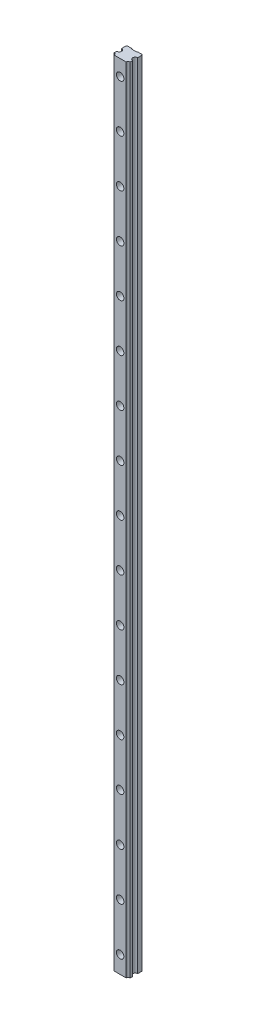
from build123d import *

# Parameters (mm, degrees)
RESSALTO_EXTRUS_O1_DEPTH = 1000
ESBO_O2_R                = 2.87
CORTE_EXTRUS_O1_DEPTH    = 17.57
ESBO_O3_R                = 4.715
CORTE_EXTRUS_O2_DEPTH    = 8.49


with BuildPart() as part:
    # Esboço1 → Ressalto-extrusão1 (new body)
    with BuildSketch(Plane(origin=(0, 0, 0), x_dir=(1, 0, 0), z_dir=(0, 1, 0))):
        with BuildLine():
            Line((-10.048, -3.265), (-10.048, -6.485))
            Line((-10.048, -6.485), (-9.645814792, -6.485))
            ThreePointArc((-9.645814792, -6.485), (-8.23160123, -7.070786438), (-7.645814792, -8.485))
            Line((-7.645814792, -8.485), (-7.645814792, -8.985))
            Line((-7.645814792, -8.985), (7.652, -8.985))
            Line((7.652, -8.985), (7.652, -8.485))
            ThreePointArc((7.652, -8.485), (8.237786438, -7.070786438), (9.652, -6.485))
            Line((9.652, -6.485), (10.152, -6.485))
            Line((10.152, -6.485), (10.152, -3.265))
            ThreePointArc((10.152, -3.265), (7.052, -0.165), (10.152, 2.935))
            Line((10.152, 2.935), (10.152, 8.315))
            Line((10.152, 8.315), (9.152, 9.315))
            Line((9.152, 9.315), (3.667, 9.315))
            Line((3.667, 9.315), (3.667, 8.585))
            Line((3.667, 8.585), (-3.563, 8.585))
            Line((-3.563, 8.585), (-3.563, 9.315))
            Line((-3.563, 9.315), (-9.048, 9.315))
            Line((-9.048, 9.315), (-10.048, 8.315))
            Line((-10.048, 8.315), (-10.048, 2.935))
            ThreePointArc((-10.048, 2.935), (-6.948, -0.165), (-10.048, -3.265))
        make_face()
    extrude(amount=-RESSALTO_EXTRUS_O1_DEPTH)

    # Esboço2 → Corte-extrusão1 (cut)
    with BuildSketch(Plane(origin=(0, 0, -8.585), x_dir=(-1, 0, 0), z_dir=(0, 0, -1))):
        with Locations((0, -19.745)):
            Circle(ESBO_O2_R)
        with Locations((0, -79.655)):
            Circle(ESBO_O2_R)
        with Locations((0, -139.565)):
            Circle(ESBO_O2_R)
        with Locations((0, -199.475)):
            Circle(ESBO_O2_R)
        with Locations((0, -259.385)):
            Circle(ESBO_O2_R)
        with Locations((0, -319.295)):
            Circle(ESBO_O2_R)
        with Locations((0, -379.205)):
            Circle(ESBO_O2_R)
        with Locations((0, -439.115)):
            Circle(ESBO_O2_R)
        with Locations((0, -499.025)):
            Circle(ESBO_O2_R)
        with Locations((0, -558.935)):
            Circle(ESBO_O2_R)
        with Locations((0, -618.845)):
            Circle(ESBO_O2_R)
        with Locations((0, -678.755)):
            Circle(ESBO_O2_R)
        with Locations((0, -738.665)):
            Circle(ESBO_O2_R)
        with Locations((0, -798.575)):
            Circle(ESBO_O2_R)
        with Locations((0, -858.485)):
            Circle(ESBO_O2_R)
        with Locations((0, -918.395)):
            Circle(ESBO_O2_R)
        with Locations((0, -978.305)):
            Circle(ESBO_O2_R)
    extrude(amount=-CORTE_EXTRUS_O1_DEPTH, mode=Mode.SUBTRACT)

    # Esboço3 → Corte-extrusão2 (cut)
    with BuildSketch(Plane.XY.offset(8.985)):
        with Locations((0.003092604, -19.745)):
            Circle(ESBO_O3_R)
        with Locations((0.003092604, -79.645)):
            Circle(ESBO_O3_R)
        with Locations((0.003092604, -139.545)):
            Circle(ESBO_O3_R)
        with Locations((0.003092604, -199.445)):
            Circle(ESBO_O3_R)
        with Locations((0.003092604, -259.345)):
            Circle(ESBO_O3_R)
        with Locations((0.003092604, -319.245)):
            Circle(ESBO_O3_R)
        with Locations((0.003092604, -379.145)):
            Circle(ESBO_O3_R)
        with Locations((0.003092604, -439.045)):
            Circle(ESBO_O3_R)
        with Locations((0.003092604, -498.945)):
            Circle(ESBO_O3_R)
        with Locations((0.003092604, -558.845)):
            Circle(ESBO_O3_R)
        with Locations((0.003092604, -618.745)):
            Circle(ESBO_O3_R)
        with Locations((0.003092604, -678.645)):
            Circle(ESBO_O3_R)
        with Locations((0.003092604, -738.545)):
            Circle(ESBO_O3_R)
        with Locations((0.003092604, -798.445)):
            Circle(ESBO_O3_R)
        with Locations((0.003092604, -858.345)):
            Circle(ESBO_O3_R)
        with Locations((0.003092604, -918.245)):
            Circle(ESBO_O3_R)
        with Locations((0.003092604, -978.145)):
            Circle(ESBO_O3_R)
    extrude(amount=-CORTE_EXTRUS_O2_DEPTH, mode=Mode.SUBTRACT)


solid = part.part
